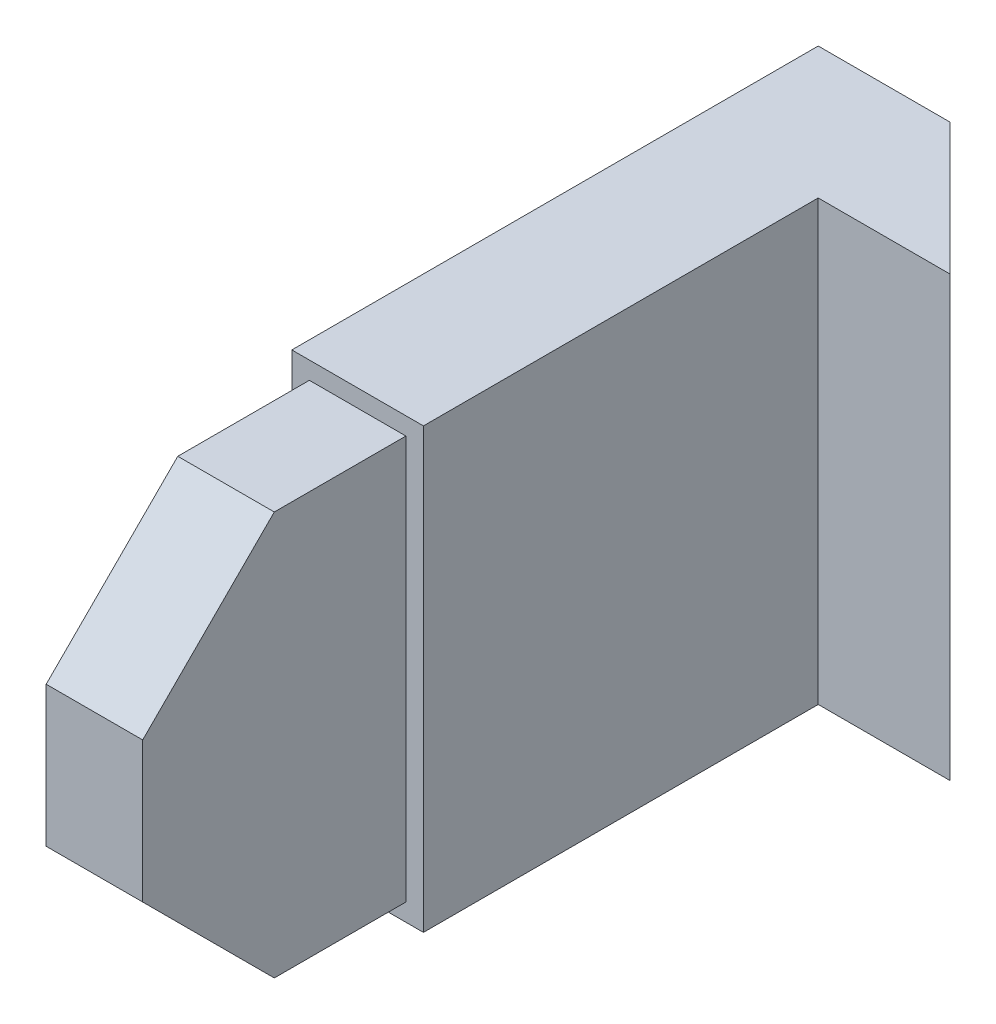
from build123d import *

# Parameters (mm, degrees)
BOSS_EXTRUDE1_DEPTH = 5
SKETCH2_W           = 1.1
SKETCH2_H           = 4.6
BOSS_EXTRUDE2_DEPTH = 3
CUT_EXTRUDE1_REACH  = 9.993


with BuildPart() as part:
    # Sketch1 → Boss-Extrude1 (new body)
    with BuildSketch(Plane(origin=(0, 0, 0), x_dir=(1, 0, 0), z_dir=(0, 1, 0))):
        Polygon((0.75, 1.5), (2.25, 1.5), (0.75, 3), (-0.75, 3), (-0.75, -3), (-0.7, -3), (0.7, -3), (0.75, -3), align=None)
    extrude(amount=BOSS_EXTRUDE1_DEPTH)

    # Sketch2 → Boss-Extrude2 (add)
    with BuildSketch(Plane.XY.offset(3)):
        with Locations((0, 2.5)):
            Rectangle(SKETCH2_W, SKETCH2_H)
    extrude(amount=BOSS_EXTRUDE2_DEPTH)

    # Sketch3 → Cut-Extrude1 (cut, up to next)
    with BuildSketch(Plane(origin=(0.55, 0, 0), x_dir=(0, 0, -1), z_dir=(1, 0, 0)), mode=Mode.PRIVATE) as cut_extrude1_sk1:
        Polygon((-6, 3.3), (-4.5, 4.8), (-6, 4.8), align=None)
    cut_extrude1_tool1 = extrude(cut_extrude1_sk1.sketch, amount=-CUT_EXTRUDE1_REACH, mode=Mode.PRIVATE) & part.part
    cut_extrude1 = cut_extrude1_tool1.solids().sort_by_distance((0.55, 4.3, 5.5))[0]
    add(cut_extrude1, mode=Mode.SUBTRACT)

    # Mirror1: Cut-Extrude1 across plane
    add(cut_extrude1.mirror(Plane.ZX.offset(2.5)), mode=Mode.SUBTRACT)


solid = part.part
